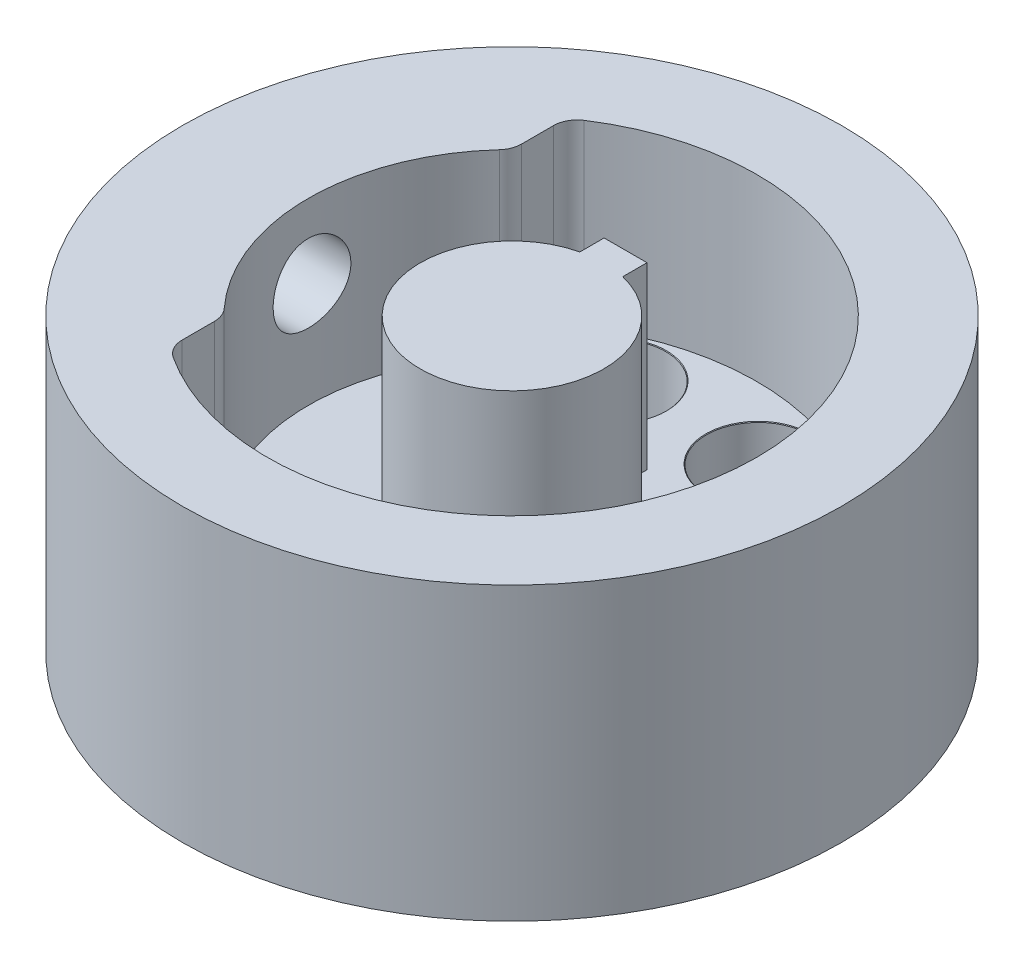
from build123d import *

# Parameters (mm, degrees)
SKETCH1_R                             = 14
BOSS_EXTRUDE1_DEPTH                   = 4.75
BOSS_EXTRUDE4_DEPTH                   = 7.61416499
BOSS_EXTRUDE5_START                   = 7.61416499
SKETCH5_R                             = 14
BOSS_EXTRUDE5_DEPTH                   = 7.61416499
TAP_DRILL_FOR_M4X0_7_TAP2_D           = 3.3
TAP_DRILL_FOR_M4X0_7_TAP2_DEPTH       = 13.724
TAP_DRILL_FOR_M4X0_7_TAP2_CSINK_D     = 3.35
TAP_DRILL_FOR_M4X0_7_TAP2_CSINK_ANGLE = 90
TAP_DRILL_FOR_M4X0_7_TAP2_TIP         = 0.991420021
FILLET2_R                             = 1
CBORE_FOR_M2_SHCS3_AT_2_COUNT         = 2
CBORE_FOR_M2_SHCS3_AT_2_PITCH         = 6.122934918
CBORE_FOR_M2_SHCS3_AT_3_COUNT         = 2
CBORE_FOR_M2_SHCS3_AT_3_PITCH         = 11.313708499
CBORE_FOR_M2_SHCS3_AT_4_COUNT         = 2
CBORE_FOR_M2_SHCS3_AT_4_PITCH         = 14.78207252
CBORE_FOR_M2_SHCS3_AT_5_COUNT         = 2
CBORE_FOR_M2_SHCS3_AT_5_PITCH         = 16
CBORE_FOR_M2_SHCS3_AT_6_COUNT         = 2
CBORE_FOR_M2_SHCS3_AT_6_PITCH         = 14.78207252
SKETCH20_R                            = 4
CUT_EXTRUDE2_DEPTH                    = 2.75
SKETCH21_R                            = 2
CUT_EXTRUDE3_DEPTH                    = 2.5


with BuildPart() as part:
    # Sketch1 → Boss-Extrude1 (new body)
    with BuildSketch(Plane(origin=(0, 0, 0), x_dir=(1, 0, 0), z_dir=(0, 1, 0))):
        with Locations(Location((0, 0, 0), (0, 0, 270))):
            Circle(SKETCH1_R)
    extrude(amount=-BOSS_EXTRUDE1_DEPTH)

    # Sketch4 → Boss-Extrude4 (add)
    with BuildSketch(Plane(origin=(0, 0, 0), x_dir=(1, 0, 0), z_dir=(0, 1, 0))):
        with BuildLine():
            ThreePointArc((3.9, 0), (3.062596937, 2.414642831), (0.91, 3.792347558))
            Line((0.91, 3.792347558), (-0.91, 3.792347558))
            ThreePointArc((-0.91, 3.792347558), (-2.414642831, -3.062596937), (3.9, 0))
        make_face()
        with BuildLine():
            Line((-0.91, 3.792347558), (0.91, 3.792347558))
            ThreePointArc((0.91, 3.792347558), (0, 3.9), (-0.91, 3.792347558))
        make_face()
        with BuildLine():
            Line((0.91, 3.792347558), (0.91, 4.821959978))
            Line((0.91, 4.821959978), (-0.91, 4.821959978))
            Line((-0.91, 4.821959978), (-0.91, 3.792347558))
            ThreePointArc((-0.91, 3.792347558), (0, 3.9), (0.91, 3.792347558))
        make_face()
    extrude(amount=BOSS_EXTRUDE4_DEPTH)

    # Sketch5 → Boss-Extrude5 (add)
    with BuildSketch(Plane(origin=(0, 0, 0), x_dir=(1, 0, 0), z_dir=(0, 1, 0)).offset(BOSS_EXTRUDE5_START)):
        with Locations(Location((0, 0, 0), (0, 0, 270))):
            Circle(SKETCH5_R)
        with BuildLine():
            ThreePointArc((-6.116473657, 8.411227616), (10.4, 0), (-6.116473657, -8.411227616))
            Line((-6.116473657, -8.411227616), (-6.116473657, -6.116473657))
            ThreePointArc((-6.116473657, -6.116473657), (-8.65, 0), (-6.116473657, 6.116473657))
            Line((-6.116473657, 6.116473657), (-6.116473657, 8.411227616))
        make_face(mode=Mode.SUBTRACT)
    extrude(amount=-BOSS_EXTRUDE5_DEPTH)

    # Tap Drill for M4x0.7 Tap2
    with Locations(Plane(origin=(-20, 0, 0), x_dir=(0, 0, -1), z_dir=(-1, 0, 0))):
        with Locations((0, -4.48916499)):
            CounterSinkHole(TAP_DRILL_FOR_M4X0_7_TAP2_D / 2, TAP_DRILL_FOR_M4X0_7_TAP2_CSINK_D / 2, depth=TAP_DRILL_FOR_M4X0_7_TAP2_DEPTH, counter_sink_angle=TAP_DRILL_FOR_M4X0_7_TAP2_CSINK_ANGLE)
            with Locations((0, 0, -(TAP_DRILL_FOR_M4X0_7_TAP2_DEPTH + TAP_DRILL_FOR_M4X0_7_TAP2_TIP / 2))):  # 118° drill point
                Cone(0, TAP_DRILL_FOR_M4X0_7_TAP2_D / 2, TAP_DRILL_FOR_M4X0_7_TAP2_TIP, mode=Mode.SUBTRACT)

    # Fillet2
    fillet2_edges = [part.edges().sort_by_distance(p)[0] for p in [
        (-6.116473657, 3.807082495, -8.411227616),
        (-6.116473657, 3.807082495, 8.411227616),
        (-6.116473657, 3.807082495, 6.116473657),
        (-6.116473657, 3.807082495, -6.116473657),
    ]]
    fillet(fillet2_edges, radius=FILLET2_R)

    # Sketch19 → CBORE for M2 SHCS3 (revolve, cut)
    with BuildSketch(Plane(origin=(-3.061467459, 0, -7.39103626), x_dir=(0, 0, 1), z_dir=(1, 0, 0))):
        Polygon((0, 0), (0, 5.471032743), (1.2, 4.75), (1.2, 3.5), (2.2, 3.5), (2.2, 0.025), (2.225, 0), align=None)
    cbore_for_m2_shcs3 = revolve(axis=Axis((-3.061467459, 6.35, -7.39103626), (0, -1, 0)), mode=Mode.SUBTRACT)

    # CBORE for M2 SHCS3 at 2: CBORE for M2 SHCS3 ×2
    with Locations(*[(i * CBORE_FOR_M2_SHCS3_AT_2_PITCH, 0, 0) for i in range(1, CBORE_FOR_M2_SHCS3_AT_2_COUNT)]):
        add(cbore_for_m2_shcs3, mode=Mode.SUBTRACT)

    # CBORE for M2 SHCS3 at 3: CBORE for M2 SHCS3 ×2
    with Locations(*[Vector(0.9238795325112845, 0, 0.38268343236509533) * (i * CBORE_FOR_M2_SHCS3_AT_3_PITCH) for i in range(1, CBORE_FOR_M2_SHCS3_AT_3_COUNT)]):
        add(cbore_for_m2_shcs3, mode=Mode.SUBTRACT)

    # CBORE for M2 SHCS3 at 4: CBORE for M2 SHCS3 ×2
    with Locations(*[Vector(0.7071067811865439, 0, 0.7071067811865512) * (i * CBORE_FOR_M2_SHCS3_AT_4_PITCH) for i in range(1, CBORE_FOR_M2_SHCS3_AT_4_COUNT)]):
        add(cbore_for_m2_shcs3, mode=Mode.SUBTRACT)

    # CBORE for M2 SHCS3 at 5: CBORE for M2 SHCS3 ×2
    with Locations(*[Vector(0.3826834323650841, 0, 0.9238795325112892) * (i * CBORE_FOR_M2_SHCS3_AT_5_PITCH) for i in range(1, CBORE_FOR_M2_SHCS3_AT_5_COUNT)]):
        add(cbore_for_m2_shcs3, mode=Mode.SUBTRACT)

    # CBORE for M2 SHCS3 at 6: CBORE for M2 SHCS3 ×2
    with Locations(*[(0, 0, i * CBORE_FOR_M2_SHCS3_AT_6_PITCH) for i in range(1, CBORE_FOR_M2_SHCS3_AT_6_COUNT)]):
        add(cbore_for_m2_shcs3, mode=Mode.SUBTRACT)

    # Sketch20 → Cut-Extrude2 (cut)
    with BuildSketch(Plane.XZ.offset(4.75)):
        with Locations(Location((0, 0, 0), (0, 0, 270))):
            Circle(SKETCH20_R)
    extrude(amount=-CUT_EXTRUDE2_DEPTH, mode=Mode.SUBTRACT)

    # Sketch21 → Cut-Extrude3 (cut)
    with BuildSketch(Plane(origin=(0, -2, 0), x_dir=(-1, 0, 0), z_dir=(0, -1, 0))):
        with Locations(Location((0, 0, 0), (0, 0, 90))):
            Circle(SKETCH21_R)
    extrude(amount=-CUT_EXTRUDE3_DEPTH, mode=Mode.SUBTRACT)


solid = part.part
